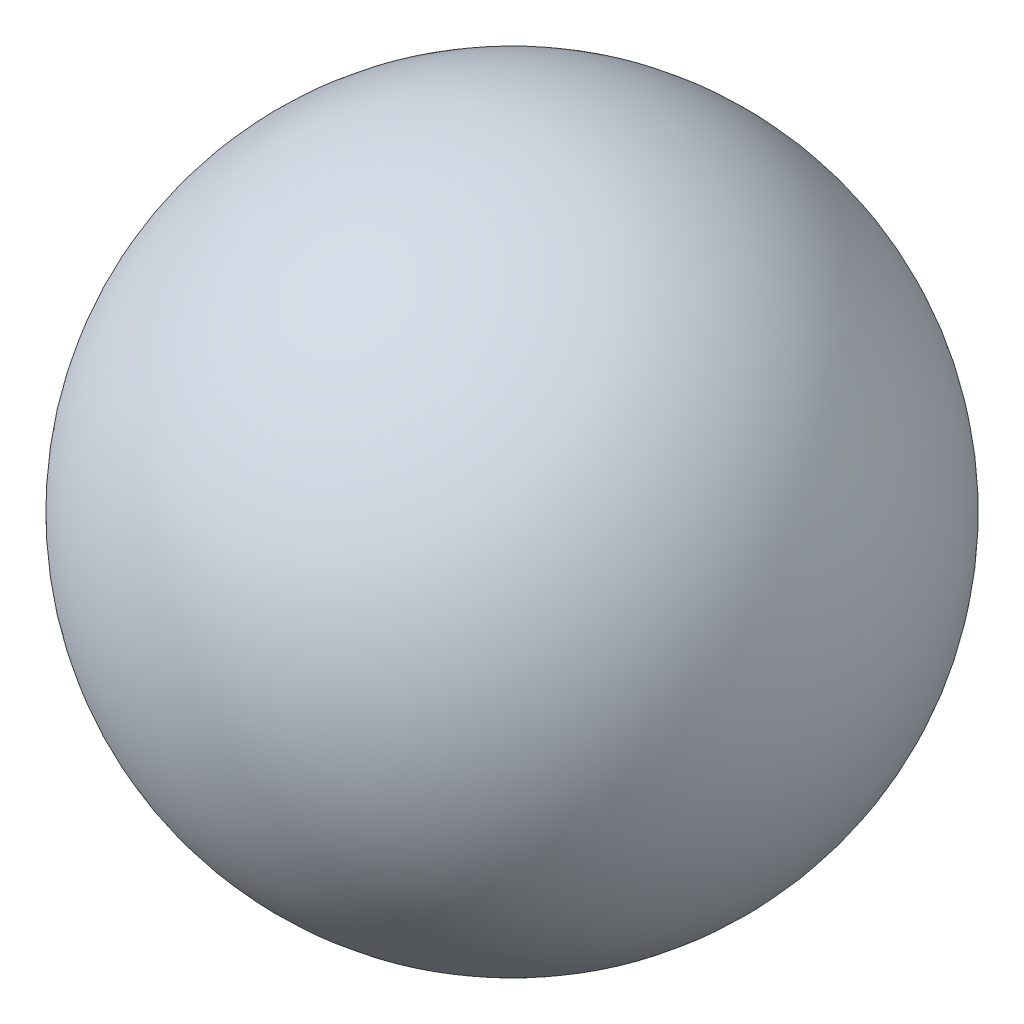
from build123d import *


with BuildPart() as part:
    # Sketch1 → Revolve1 (revolve)
    with BuildSketch(Plane.XY):
        with BuildLine():
            Line((0, 4.524151478), (0, -4.524151478))
            ThreePointArc((0, -4.524151478), (4.524151478, 0), (0, 4.524151478))
        make_face()
    revolve(axis=Axis((0, 4.524151478, 0), (0, -1, 0)))


solid = part.part
